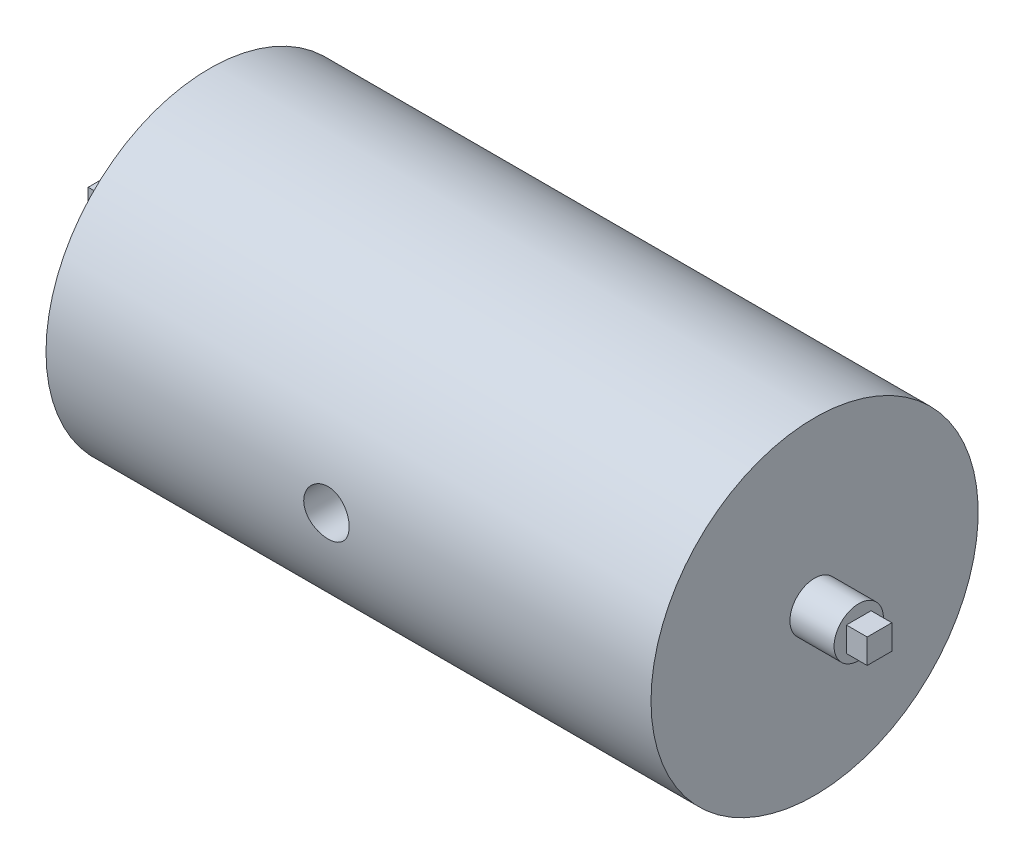
from build123d import *

# Parameters (mm, degrees)
ESQUISSE5_W                  = 4.75
ESQUISSE5_H                  = 4.75
BOSS_EXTRU_3_DEPTH           = 4
BOSS_EXTRU_4_DEPTH           = 4
ESQUISSE10_R                 = 4.375
ENL_V_MAT_EXTRU_2_DEPTH      = 50
ENL_V_MAT_EXTRU_3_DEPTH      = 50
ENL_V_MAT_EXTRU_3_DEPTH_BACK = 50
ESQUISSE11_R                 = 4.375


with BuildPart() as part:
    # Esquisse1 → Révolution1 (revolve)
    with BuildSketch(Plane(origin=(0, 0, 0), x_dir=(1, 0, 0), z_dir=(0, 1, 0))):
        Polygon((0, 0), (0, 4.75), (142, 4.75), (142, 0), (133.5, 0), (133.5, -26.75), (17, -26.75), (17, 0), align=None)
    revolve(axis=Axis((0, 0, -4.75), (1, 0, 0)))

    # Esquisse5 → Boss.-Extru.3 (add)
    with BuildSketch(Plane(origin=(142, 0, 0), x_dir=(0, 0, -1), z_dir=(1, 0, 0))):
        with Locations((4.75, 0)):
            Rectangle(ESQUISSE5_W, ESQUISSE5_H)
    extrude(amount=BOSS_EXTRU_3_DEPTH)

    # Esquisse6 → Boss.-Extru.4 (add)
    with BuildSketch(Plane.ZY):
        Polygon((-4.75, 2.375), (-7.125, 2.375), (-7.125, -2.375), (-2.375, -2.375), (-2.375, 2.375), align=None)
    extrude(amount=BOSS_EXTRU_4_DEPTH)

    # Esquisse10 → Enlèv. mat.-Extru.2 (cut)
    with BuildSketch(Plane.XY):
        Polygon((63.31, 0), (67.155, -6.659735355), (74.845, -6.659735355), (78.69, 0), (74.845, 6.659735355), (67.155, 6.659735355), align=None)
        with Locations((71, 0)):
            Circle(ESQUISSE10_R, mode=Mode.SUBTRACT)
    extrude(amount=-ENL_V_MAT_EXTRU_2_DEPTH, mode=Mode.SUBTRACT)

    # Esquisse11 → Enlèv. mat.-Extru.3 (cut, two sides: drawn at the far end of the back side and taken through both)
    with BuildSketch(Plane.XY.offset(-ENL_V_MAT_EXTRU_3_DEPTH_BACK)):
        with Locations((71, 0)):
            Circle(ESQUISSE11_R)
    extrude(amount=ENL_V_MAT_EXTRU_3_DEPTH + ENL_V_MAT_EXTRU_3_DEPTH_BACK, mode=Mode.SUBTRACT)


solid = part.part
